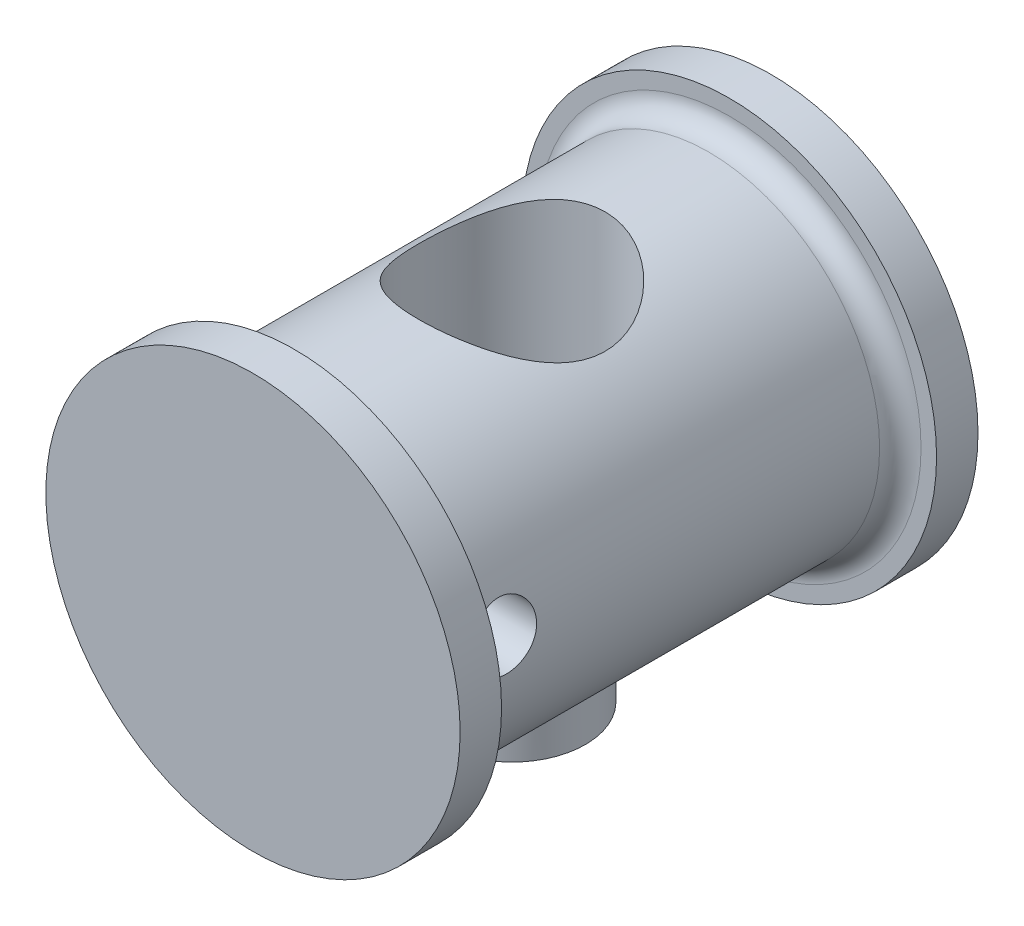
from build123d import *

# Parameters (mm, degrees)
SKIZZE1_R                            = 10
AUFSATZ_LINEAR_AUSTRAGEN1_DEPTH      = 2
SKIZZE2_R                            = 8.25
AUFSATZ_LINEAR_AUSTRAGEN2_DEPTH      = 21
SKIZZE3_R                            = 10
AUFSATZ_LINEAR_AUSTRAGEN3_DEPTH      = 2
VERRUNDUNG1_R                        = 1
SCHNITT_LINEAR_AUSTRAGEN1_DEPTH      = 14
SCHNITT_LINEAR_AUSTRAGEN1_DEPTH_BACK = 14
SKIZZE4_R                            = 1.5
SCHNITT_LINEAR_AUSTRAGEN2_DEPTH      = 14
SCHNITT_LINEAR_AUSTRAGEN2_DEPTH_BACK = 1
SKIZZE5_R                            = 4.5
SKIZZE6_R                            = 2.55
SCHNITT_LINEAR_AUSTRAGEN3_DEPTH      = 14
SKIZZE7_R                            = 3.55
SKIZZE7_R_2                          = 2.55
AUFSATZ_LINEAR_AUSTRAGEN4_DEPTH      = 10


with BuildPart() as part:
    # Skizze1 → Aufsatz-Linear austragen1 (new body)
    with BuildSketch(Plane.XY):
        Circle(SKIZZE1_R)
    extrude(amount=AUFSATZ_LINEAR_AUSTRAGEN1_DEPTH)

    # Skizze2 → Aufsatz-Linear austragen2 (add)
    with BuildSketch(Plane.XY.offset(2)):
        Circle(SKIZZE2_R)
    extrude(amount=AUFSATZ_LINEAR_AUSTRAGEN2_DEPTH)

    # Skizze3 → Aufsatz-Linear austragen3 (add)
    with BuildSketch(Plane.XY.offset(23)):
        Circle(SKIZZE3_R)
    extrude(amount=AUFSATZ_LINEAR_AUSTRAGEN3_DEPTH)

    # Verrundung1
    verrundung1_edges = [part.edges().sort_by_distance(p)[0] for p in [
        (-8.25, 0, 23),
        (-8.25, 0, 2),
    ]]
    fillet(verrundung1_edges, radius=VERRUNDUNG1_R)

    # Skizze4 → Schnitt-Linear austragen1 (cut, two sides: drawn at the far end of the back side and taken through both)
    with BuildSketch(Plane.ZY.offset(-SCHNITT_LINEAR_AUSTRAGEN1_DEPTH_BACK)):
        with Locations((21, 1.05)):
            Circle(SKIZZE4_R)
    extrude(amount=SCHNITT_LINEAR_AUSTRAGEN1_DEPTH + SCHNITT_LINEAR_AUSTRAGEN1_DEPTH_BACK, mode=Mode.SUBTRACT)

    # Skizze5 → Schnitt-Linear austragen2 (cut, two sides: drawn at the far end of the back side and taken through both)
    with BuildSketch(Plane(origin=(0, 0, 0), x_dir=(1, 0, 0), z_dir=(0, 1, 0)).offset(-SCHNITT_LINEAR_AUSTRAGEN2_DEPTH_BACK)):
        with Locations((0, -12.5)):
            Circle(SKIZZE5_R)
    extrude(amount=SCHNITT_LINEAR_AUSTRAGEN2_DEPTH + SCHNITT_LINEAR_AUSTRAGEN2_DEPTH_BACK, mode=Mode.SUBTRACT)

    # Skizze6 → Schnitt-Linear austragen3 (cut)
    with BuildSketch(Plane(origin=(0, -1, 0), x_dir=(1, 0, 0), z_dir=(0, 1, 0))):
        with Locations((0, -12.5)):
            Circle(SKIZZE6_R)
    extrude(amount=-SCHNITT_LINEAR_AUSTRAGEN3_DEPTH, mode=Mode.SUBTRACT)

    # Skizze7 → Aufsatz-Linear austragen4 (add)
    with BuildSketch(Plane(origin=(0, 0, 0), x_dir=(1, 0, 0), z_dir=(0, 1, 0))):
        with Locations((0, -12.5)):
            Circle(SKIZZE7_R)
        with Locations((0, -12.5)):
            Circle(SKIZZE7_R_2, mode=Mode.SUBTRACT)
    extrude(amount=-AUFSATZ_LINEAR_AUSTRAGEN4_DEPTH)


solid = part.part
